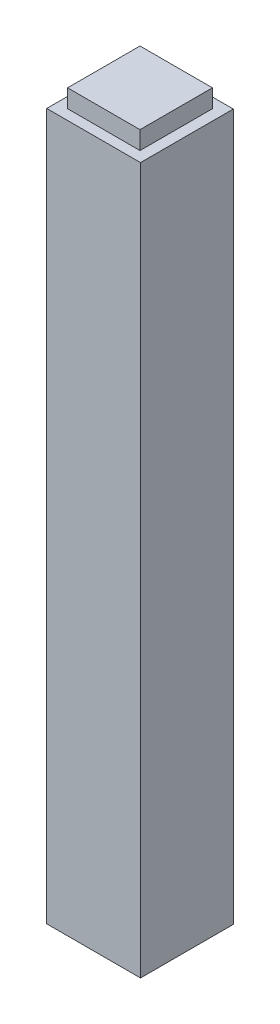
from build123d import *

# Parameters (mm, degrees)
SCHIZZO2_W                   = 40
SCHIZZO2_H                   = 40
ESTRUSIONE_ESTRUSIONE1_DEPTH = 400
SCHIZZO3_W                   = 51.798168148
SCHIZZO3_H                   = 51.239214106
ESTRUSIONE_ESTRUSIONE2_DEPTH = 390


with BuildPart() as part:
    # Schizzo2 → Estrusione-Estrusione1 (new body)
    with BuildSketch(Plane(origin=(0, 0, 0), x_dir=(1, 0, 0), z_dir=(0, 1, 0))):
        Rectangle(SCHIZZO2_W, SCHIZZO2_H)
    extrude(amount=ESTRUSIONE_ESTRUSIONE1_DEPTH)


with BuildPart() as body_2:
    # Schizzo3 → Estrusione-Estrusione2 (new body)
    with BuildSketch(Plane(origin=(0, 0, 0), x_dir=(-1, 0, 0), z_dir=(0, -1, 0))):
        Rectangle(SCHIZZO3_W, SCHIZZO3_H)
    extrude(amount=-ESTRUSIONE_ESTRUSIONE2_DEPTH)


solid = Compound([part.part, body_2.part])
